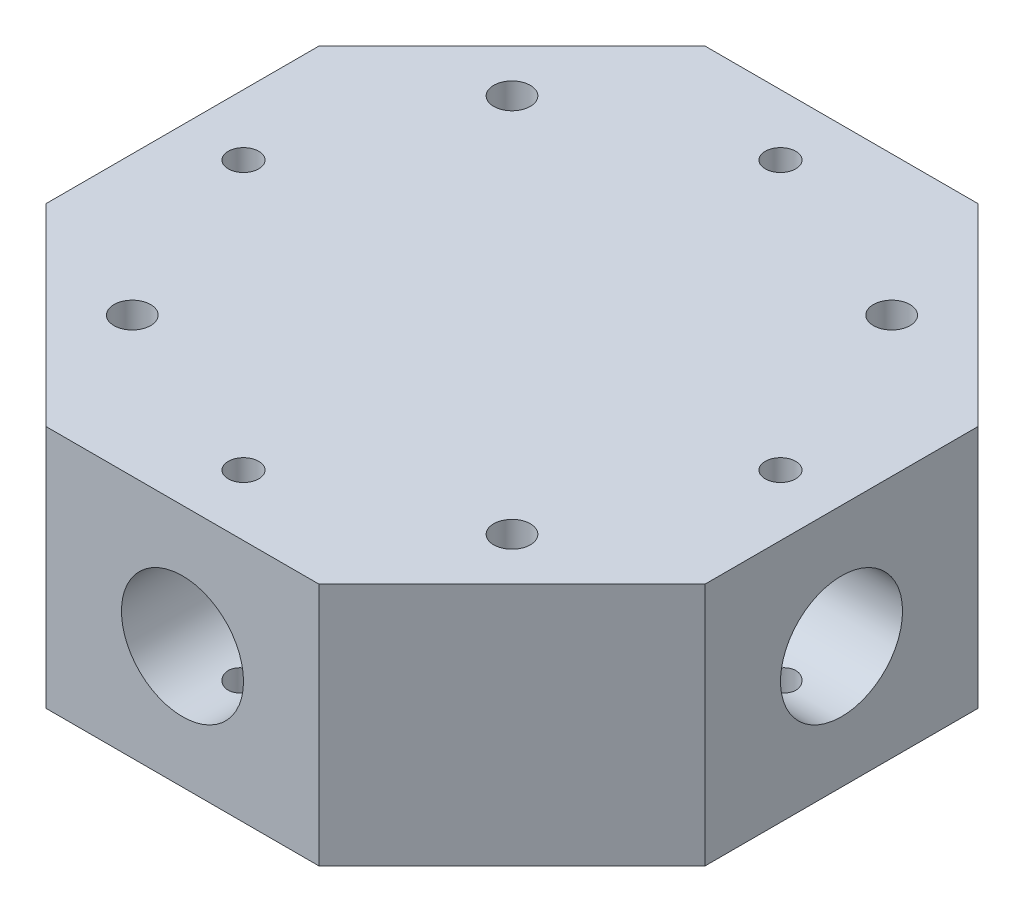
from build123d import *

# Parameters (mm, degrees)
SKETCH1_R           = 1.25
SKETCH1_R_2         = 1.5
BOSS_EXTRUDE1_DEPTH = 10
CUT_EXTRUDE4_REACH  = 63.196
SKETCH7_R           = 5
CUT_EXTRUDE5_REACH  = 63.196
SKETCH8_R           = 5


with BuildPart() as part:
    # Sketch1 → Boss-Extrude1 (new, symmetric)
    with BuildSketch(Plane(origin=(0, 0, 0), x_dir=(1, 0, 0), z_dir=(0, 1, 0))):
        Polygon((11.183766184, 27), (-11.183766184, 27), (-27, 11.183766184), (-27, -11.183766184), (-11.183766184, -27), (11.183766184, -27), (27, -11.183766184), (27, 11.183766184), align=None)
        with Locations(Location((0, 22, 0), (0, 0, 270))):
            Circle(SKETCH1_R, mode=Mode.SUBTRACT)
        with Locations(Location((15.556349186, 15.556349186, 0), (0, 0, 270))):
            Circle(SKETCH1_R_2, mode=Mode.SUBTRACT)
        with Locations(Location((22, 0, 0), (0, 0, 270))):
            Circle(SKETCH1_R, mode=Mode.SUBTRACT)
        with Locations(Location((15.556349186, -15.556349186, 0), (0, 0, 270))):
            Circle(SKETCH1_R_2, mode=Mode.SUBTRACT)
        with Locations(Location((0, -22, 0), (0, 0, 270))):
            Circle(SKETCH1_R, mode=Mode.SUBTRACT)
        with Locations(Location((-15.556349186, -15.556349186, 0), (0, 0, 270))):
            Circle(SKETCH1_R_2, mode=Mode.SUBTRACT)
        with Locations(Location((-22, 0, 0), (0, 0, 270))):
            Circle(SKETCH1_R, mode=Mode.SUBTRACT)
        with Locations(Location((-15.556349186, 15.556349186, 0), (0, 0, 270))):
            Circle(SKETCH1_R_2, mode=Mode.SUBTRACT)
    extrude(amount=BOSS_EXTRUDE1_DEPTH, both=True)

    # Cut-Extrude4: up to this face of the body (flat: up to its plane)
    cut_extrude4_end = Plane(part.part.faces().sort_by_distance((0, 0, -27))[0])
    # Sketch7 → Cut-Extrude4 (cut, up to the picked face)
    with BuildSketch(Plane.XY.offset(27), mode=Mode.PRIVATE) as cut_extrude4_sk1:
        Circle(SKETCH7_R)
    cut_extrude4_tool1 = split(extrude(cut_extrude4_sk1.sketch, amount=-CUT_EXTRUDE4_REACH, mode=Mode.PRIVATE), bisect_by=cut_extrude4_end, keep=Keep.BOTH, mode=Mode.PRIVATE)
    add(cut_extrude4_tool1.solids().sort_by(Axis((0, 0, 27), (0, 0, -1)))[0], mode=Mode.SUBTRACT)

    # Cut-Extrude5: up to this face of the body (flat: up to its plane)
    cut_extrude5_end = Plane(part.part.faces().sort_by_distance((-27, 0, 0))[0])
    # Sketch8 → Cut-Extrude5 (cut, up to the picked face)
    with BuildSketch(Plane(origin=(27, 0, 0), x_dir=(0, 0, -1), z_dir=(1, 0, 0)), mode=Mode.PRIVATE) as cut_extrude5_sk1:
        Circle(SKETCH8_R)
    cut_extrude5_tool1 = split(extrude(cut_extrude5_sk1.sketch, amount=-CUT_EXTRUDE5_REACH, mode=Mode.PRIVATE), bisect_by=cut_extrude5_end, keep=Keep.BOTH, mode=Mode.PRIVATE)
    add(cut_extrude5_tool1.solids().sort_by(Axis((27, 0, 0), (-1, 0, 0)))[0], mode=Mode.SUBTRACT)


solid = part.part
